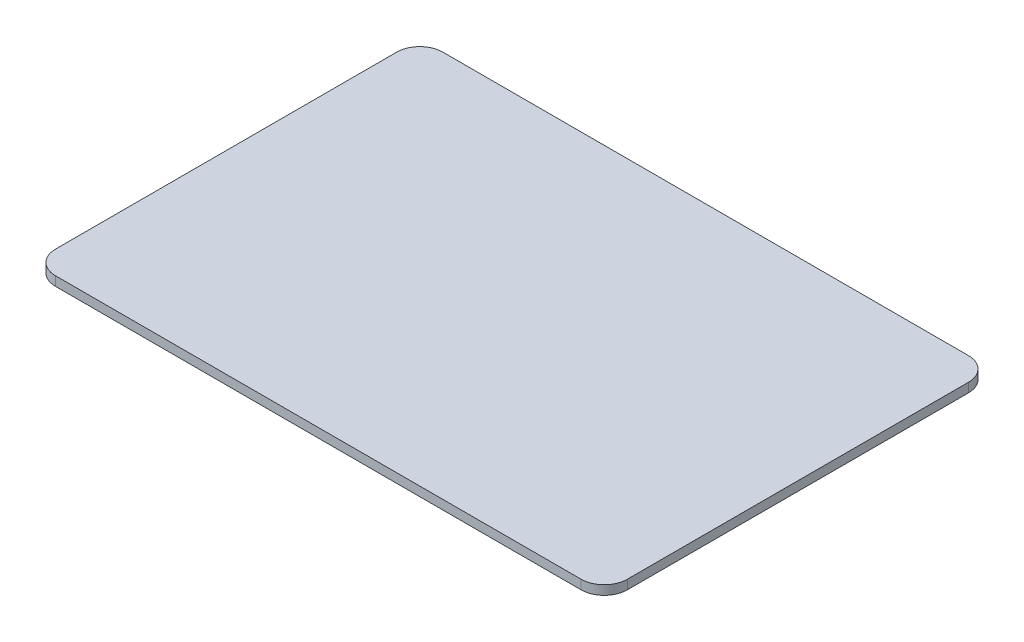
from build123d import *

# Parameters (mm, degrees)
SKETCH1_W           = 124
SKETCH1_H           = 84
BOSS_EXTRUDE1_DEPTH = 2
FILLET1_R           = 5
FILLET2_R           = 5
FILLET3_R           = 5
FILLET4_R           = 5


with BuildPart() as part:
    # Sketch1 → Boss-Extrude1 (new body)
    with BuildSketch(Plane(origin=(0, 0, 0), x_dir=(1, 0, 0), z_dir=(0, 1, 0))):
        Rectangle(SKETCH1_W, SKETCH1_H)
    extrude(amount=BOSS_EXTRUDE1_DEPTH)

    # Fillet1
    fillet1_edges = [part.edges().sort_by_distance(p)[0] for p in [
        (62, 1, 42),
    ]]
    fillet(fillet1_edges, radius=FILLET1_R)

    # Fillet2
    fillet2_edges = [part.edges().sort_by_distance(p)[0] for p in [
        (-62, 1, 42),
    ]]
    fillet(fillet2_edges, radius=FILLET2_R)

    # Fillet3
    fillet3_edges = [part.edges().sort_by_distance(p)[0] for p in [
        (-62, 1, -42),
    ]]
    fillet(fillet3_edges, radius=FILLET3_R)

    # Fillet4
    fillet4_edges = [part.edges().sort_by_distance(p)[0] for p in [
        (62, 1, -42),
    ]]
    fillet(fillet4_edges, radius=FILLET4_R)


solid = part.part
